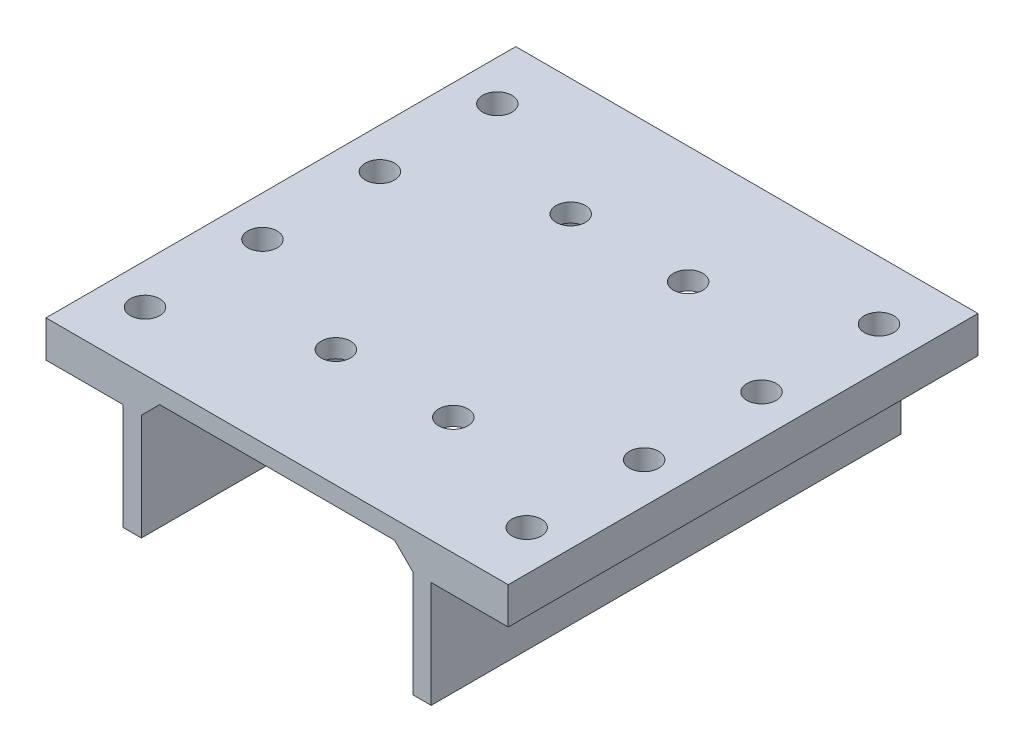
from build123d import *

# Parameters (mm, degrees)
BOSS_EXTRUDE1_DEPTH = 101.6
SKETCH2_R           = 3.175
CUT_EXTRUDE1_DEPTH  = 203.593055017
SKETCH3_R           = 3.175
CUT_EXTRUDE2_DEPTH  = 203.593055017
SKETCH4_R           = 3.175
CUT_EXTRUDE3_DEPTH  = 179.810196235


with BuildPart() as part:
    # Model → Boss-Extrude1 (new body)
    with BuildSketch(Plane.XY):
        Polygon((93.173661033, 113.358492063), (97.136061033, 117.320892063), (147.936061033, 117.320892063), (151.898461033, 113.358492063), (151.898461033, 90.346092063), (155.860861033, 90.346092063), (155.860861033, 113.358492063), (172.523261033, 113.358492063), (172.523261033, 121.283292063), (72.548861033, 121.283292063), (72.548861033, 113.358492063), (89.211261033, 113.358492063), (89.211261033, 90.346092063), (93.173661033, 90.346092063), align=None)
    extrude(amount=BOSS_EXTRUDE1_DEPTH)

    # Sketch2 → Cut-Extrude1 (cut, through all)
    with BuildSketch(Plane(origin=(0, 121.283292063, 0), x_dir=(1, 0, 0), z_dir=(0, 1, 0))):
        with Locations(Location((163.811061033, -12.7, 0), (0, 0, 270))):
            Circle(SKETCH2_R)
        with Locations(Location((163.811061033, -38.1, 0), (0, 0, 270))):
            Circle(SKETCH2_R)
        with Locations(Location((163.811061033, -63.5, 0), (0, 0, 270))):
            Circle(SKETCH2_R)
        with Locations(Location((163.811061033, -88.9, 0), (0, 0, 270))):
            Circle(SKETCH2_R)
        with Locations(Location((81.261061033, -38.1, 0), (0, 0, 270))):
            Circle(SKETCH2_R)
        with Locations(Location((81.261061033, -63.5, 0), (0, 0, 270))):
            Circle(SKETCH2_R)
        with Locations(Location((81.261061033, -88.9, 0), (0, 0, 270))):
            Circle(SKETCH2_R)
        with Locations(Location((81.261061033, -12.7, 0), (0, 0, 270))):
            Circle(SKETCH2_R)
    extrude(amount=-CUT_EXTRUDE1_DEPTH, mode=Mode.SUBTRACT)

    # Sketch3 → Cut-Extrude2 (cut, through all)
    with BuildSketch(Plane(origin=(0, 121.283292063, 0), x_dir=(1, 0, 0), z_dir=(0, 1, 0))):
        with Locations(Location((135.236061033, -25.4, 0), (0, 0, 270))):
            Circle(SKETCH3_R)
        with Locations(Location((109.836061033, -25.4, 0), (0, 0, 270))):
            Circle(SKETCH3_R)
        with Locations(Location((109.836061033, -76.2, 0), (0, 0, 270))):
            Circle(SKETCH3_R)
        with Locations(Location((135.236061033, -76.2, 0), (0, 0, 270))):
            Circle(SKETCH3_R)
    extrude(amount=-CUT_EXTRUDE2_DEPTH, mode=Mode.SUBTRACT)

    # Sketch4 → Cut-Extrude3 (cut, through all)
    with BuildSketch(Plane.ZY.offset(-89.211261033)):
        with Locations((25.4, 99.871092063)):
            Circle(SKETCH4_R)
        with Locations((76.2, 99.871092063)):
            Circle(SKETCH4_R)
    extrude(amount=-CUT_EXTRUDE3_DEPTH, mode=Mode.SUBTRACT)


solid = part.part
